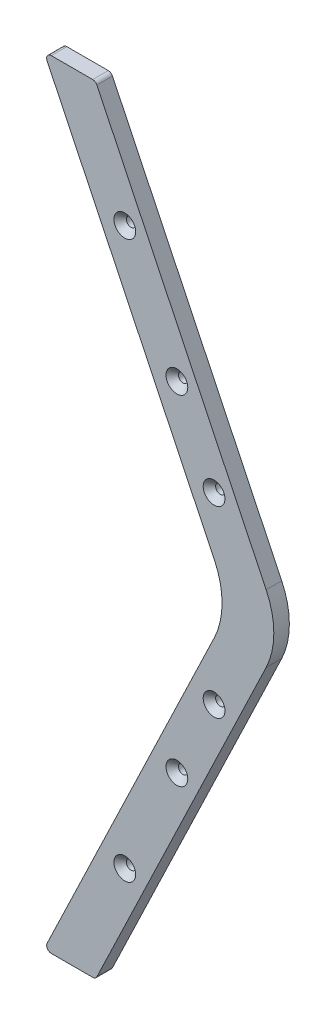
from build123d import *

# Parameters (mm, degrees)
Y_KSEKLIK_EKSTR_ZYON1_DEPTH = 10
RADYUS1_R                   = 3
RADYUS2_R                   = 50
IZIM2_R                     = 3
KES_EKSTR_ZYON1_DEPTH       = 68
PAH1_SIZE                   = 4


with BuildPart() as part:
    # Çizim1 → Yükseklik-Ekstrüzyon1 (new body)
    with BuildSketch(Plane.XY):
        Polygon((100.428030576, 0), (-19.61722488, 250), (13.66214459, 250), (133.707400046, 0), (13.66214459, -250), (-19.61722488, -250), align=None)
    extrude(amount=Y_KSEKLIK_EKSTR_ZYON1_DEPTH)

    # Radyus1
    radyus1_edges = [part.edges().sort_by_distance(p)[0] for p in [
        (-19.61722488, -250, 5),
        (13.66214459, -250, 5),
        (-19.61722488, 250, 5),
        (13.66214459, 250, 5),
    ]]
    fillet(radyus1_edges, radius=RADYUS1_R)

    # Radyus2
    radyus2_edges = [part.edges().sort_by_distance(p)[0] for p in [
        (133.707400046, 0, 5),
        (100.428030576, 0, 5),
    ]]
    fillet(radyus2_edges, radius=RADYUS2_R)

    # Çizim2 → Kes-Ekstrüzyon1 (cut)
    with BuildSketch(Plane.XY.offset(10)):
        with Locations((32.418057802, -179)):
            Circle(IZIM2_R)
        with Locations((65.910880768, -109)):
            Circle(IZIM2_R)
        with Locations((89.834325744, -59)):
            Circle(IZIM2_R)
        with Locations((65.910880768, 109)):
            Circle(IZIM2_R)
        with Locations((89.834325744, 59)):
            Circle(IZIM2_R)
        with Locations((32.418057802, 179)):
            Circle(IZIM2_R)
    extrude(amount=-KES_EKSTR_ZYON1_DEPTH, mode=Mode.SUBTRACT)

    # Pah1
    pah1_edges = [part.edges().sort_by_distance(p)[0] for p in [
        (29.418057802, -179, 10),
        (62.910880768, -109, 10),
        (86.834325744, -59, 10),
        (86.834325744, 59, 10),
        (62.910880768, 109, 10),
        (29.418057802, 179, 10),
    ]]
    chamfer(pah1_edges, length=PAH1_SIZE)


solid = part.part
